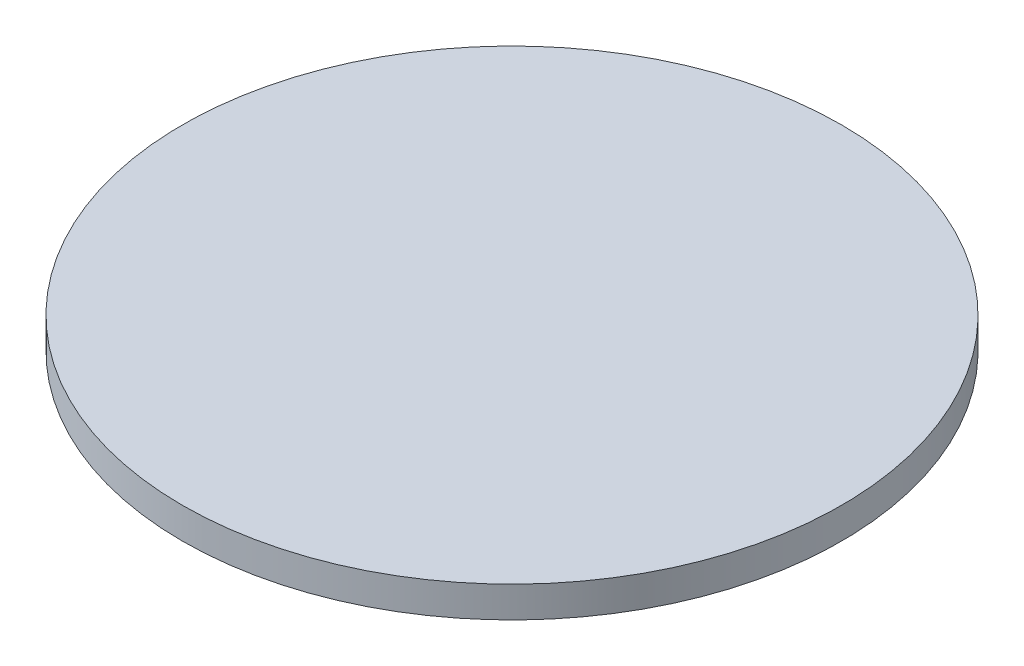
from build123d import *

# Parameters (mm, degrees)
SKETCH1_R           = 42.5
BOSS_EXTRUDE1_DEPTH = 4


with BuildPart() as part:
    # Sketch1 → Boss-Extrude1 (new body)
    with BuildSketch(Plane(origin=(0, 0, 0), x_dir=(1, 0, 0), z_dir=(0, 1, 0))):
        with Locations(Location((0, 0, 0), (0, 0, 270))):
            Circle(SKETCH1_R)
    extrude(amount=BOSS_EXTRUDE1_DEPTH)


solid = part.part
